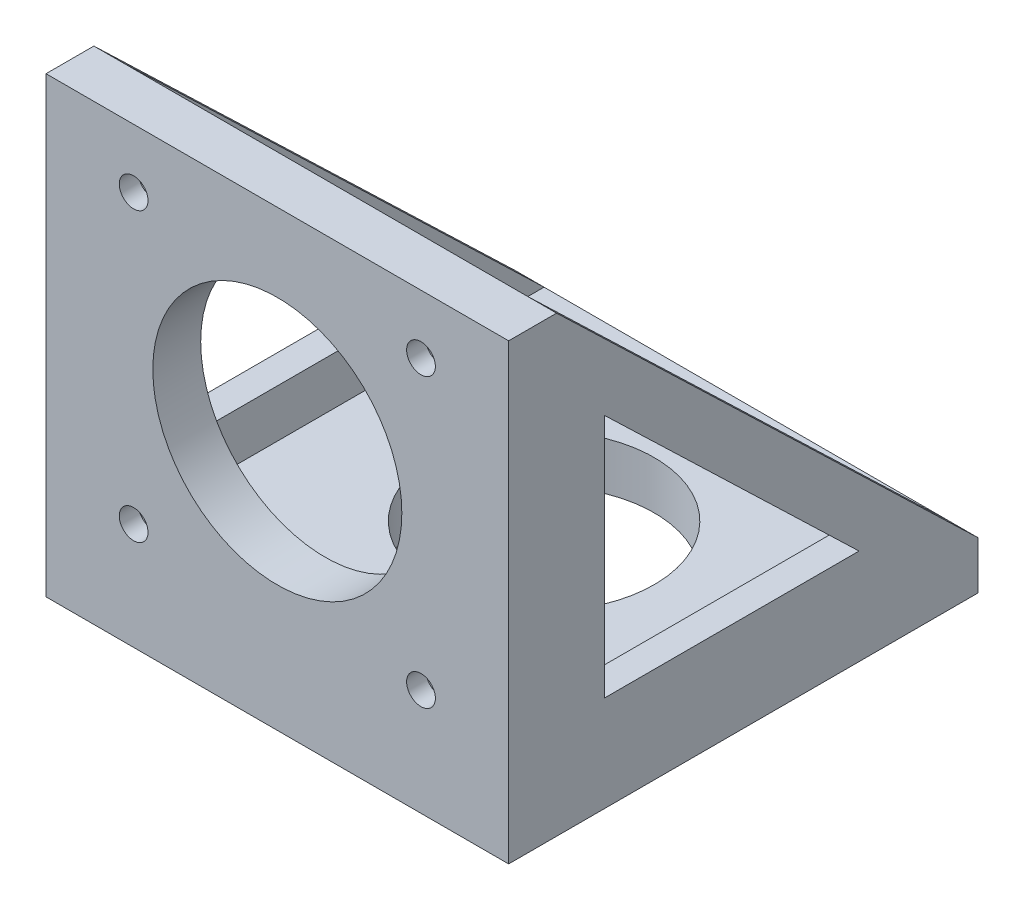
from build123d import *

# Parameters (mm, degrees)
SKETCH1_W           = 42.3
SKETCH1_H           = 49
SKETCH1_R           = 1.5
SKETCH1_R_2         = 11.5
BOSS_EXTRUDE1_DEPTH = 5
SKETCH2_W           = 42.3
SKETCH2_H           = 5
BOSS_EXTRUDE2_DEPTH = 42.3
SKETCH4_R           = 1.5
SKETCH4_R_2         = 13
CUT_EXTRUDE1_DEPTH  = 68.975087348
BOSS_EXTRUDE3_DEPTH = 3
BOSS_EXTRUDE4_DEPTH = 3
SKETCH8_R           = 3
CUT_EXTRUDE2_DEPTH  = 3
CUT_EXTRUDE3_DEPTH  = 72.905702138


with BuildPart() as part:
    # Sketch1 → Boss-Extrude1 (new body)
    with BuildSketch(Plane(origin=(0, 0, 0), x_dir=(1, 0, 0), z_dir=(0, 1, 0))):
        Rectangle(SKETCH1_W, SKETCH1_H)
        with Locations(Location((-15.5, 18.85, 0), (0, 0, 270))):
            Circle(SKETCH1_R, mode=Mode.SUBTRACT)
        with Locations(Location((15.5, 18.85, 0), (0, 0, 270))):
            Circle(SKETCH1_R, mode=Mode.SUBTRACT)
        with Locations(Location((-15.5, -12.15, 0), (0, 0, 90))):
            Circle(SKETCH1_R, mode=Mode.SUBTRACT)
        with Locations(Location((15.5, -12.15, 0), (0, 0, 90))):
            Circle(SKETCH1_R, mode=Mode.SUBTRACT)
        with Locations(Location((0, 3.35, 0), (0, 0, 270))):
            Circle(SKETCH1_R_2, mode=Mode.SUBTRACT)
    extrude(amount=BOSS_EXTRUDE1_DEPTH)

    # Sketch2 → Boss-Extrude2 (add)
    with BuildSketch(Plane(origin=(0, 5, 0), x_dir=(1, 0, 0), z_dir=(0, 1, 0))):
        with Locations((0, -22)):
            Rectangle(SKETCH2_W, SKETCH2_H)
    extrude(amount=BOSS_EXTRUDE2_DEPTH)

    # Sketch4 → Cut-Extrude1 (cut, through all)
    with BuildSketch(Plane(origin=(0, 0, 19.5), x_dir=(-1, 0, 0), z_dir=(0, 0, -1))):
        with Locations((-15, 41.15)):
            Circle(SKETCH4_R)
        with Locations((15, 41.15)):
            Circle(SKETCH4_R)
        with Locations(Location((-15, 11.15, 0), (0, 0, 180))):
            Circle(SKETCH4_R)
        with Locations(Location((15, 11.15, 0), (0, 0, 180))):
            Circle(SKETCH4_R)
        with Locations((0, 26.15)):
            Circle(SKETCH4_R_2)
    extrude(amount=-CUT_EXTRUDE1_DEPTH, mode=Mode.SUBTRACT)

    # Sketch5 → Boss-Extrude3 (add)
    with BuildSketch(Plane(origin=(21.15, 0, 0), x_dir=(0, 0, -1), z_dir=(1, 0, 0))):
        Polygon((-19.5, 47.3), (24.5, 5), (24.5, 0), (-24.5, 0), (-24.5, 47.3), align=None)
    extrude(amount=BOSS_EXTRUDE3_DEPTH)

    # Sketch6 → Boss-Extrude4 (add)
    with BuildSketch(Plane.ZY.offset(21.15)):
        Polygon((19.5, 47.3), (-24.5, 5), (-24.5, 0), (24.5, 0), (24.5, 47.3), align=None)
    extrude(amount=BOSS_EXTRUDE4_DEPTH)

    # Sketch8 → Cut-Extrude2 (cut)
    with BuildSketch(Plane(origin=(0, 0, 19.5), x_dir=(-1, 0, 0), z_dir=(0, 0, -1))):
        with Locations((-15, 41.15)):
            Circle(SKETCH8_R)
        with Locations((15, 41.15)):
            Circle(SKETCH8_R)
        with Locations((15, 11.15)):
            Circle(SKETCH8_R)
        with Locations((-15, 11.15)):
            Circle(SKETCH8_R)
    extrude(amount=-CUT_EXTRUDE2_DEPTH, mode=Mode.SUBTRACT)

    # Sketch9 → Cut-Extrude3 (cut, through all)
    with BuildSketch(Plane.ZY.offset(24.15)):
        Polygon((-12.084497186, 10), (14.5, 35.557368886), (14.5, 10), align=None)
    extrude(amount=-CUT_EXTRUDE3_DEPTH, mode=Mode.SUBTRACT)


solid = part.part
